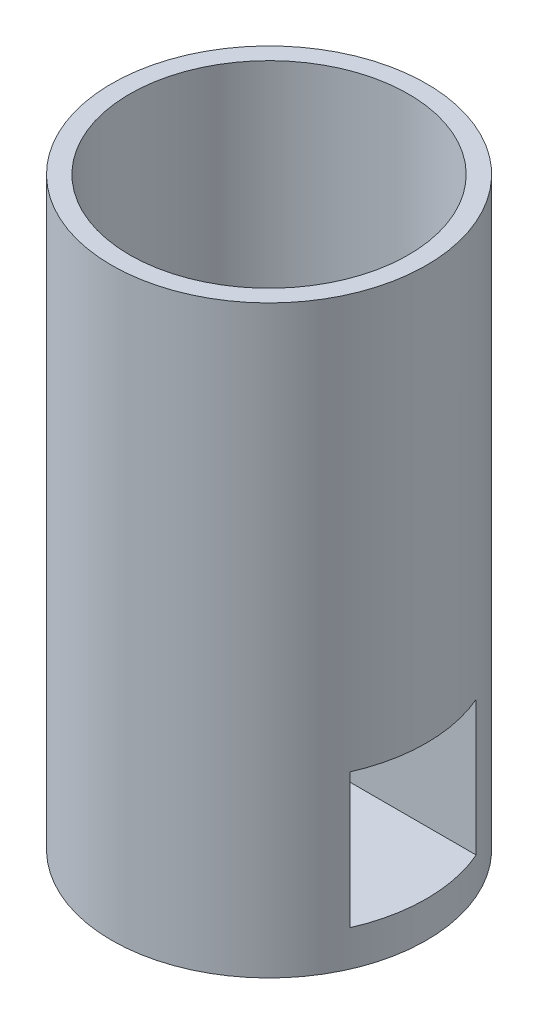
from build123d import *

# Parameters (mm, degrees)
SKETCH1_W               = 25
SKETCH1_H               = 16
BOSS_EXTRUDE1_DEPTH     = 20
SKETCH6_R               = 17.5
BOSS_EXTRUDE4_DEPTH     = 65
CUT_EXTRUDE1_DEPTH      = 65
CUT_EXTRUDE1_DEPTH_BACK = 40
SKETCH2_W               = 14
SKETCH2_H               = 15
SKETCH3_R               = 1
CUT_EXTRUDE2_DEPTH      = 10
SKETCH7_R               = 15.5
CUT_EXTRUDE3_DEPTH      = 30


with BuildPart() as part:
    # Sketch1 → Boss-Extrude1 (new body)
    with BuildSketch(Plane(origin=(0, 0, 0), x_dir=(1, 0, 0), z_dir=(0, 1, 0))):
        with Locations((3.281818182, -1.972727273)):
            Rectangle(SKETCH1_W, SKETCH1_H)
    extrude(amount=BOSS_EXTRUDE1_DEPTH)

    # Sketch6 → Boss-Extrude4 (add)
    with BuildSketch(Plane(origin=(0, 0, 0), x_dir=(1, 0, 0), z_dir=(0, 1, 0))):
        with Locations(Location((3.872523773, -1.953116283, 0), (0, 0, 270))):
            Circle(SKETCH6_R)
    extrude(amount=BOSS_EXTRUDE4_DEPTH)

    # Sketch2 → Cut-Extrude1 (cut, two sides: drawn at the far end of the back side and taken through both)
    with BuildSketch(Plane.ZY.offset(9.218181818).offset(-CUT_EXTRUDE1_DEPTH_BACK)):
        with Locations((1.972727273, 11.5)):
            Rectangle(SKETCH2_W, SKETCH2_H)
    extrude(amount=CUT_EXTRUDE1_DEPTH + CUT_EXTRUDE1_DEPTH_BACK, mode=Mode.SUBTRACT)

    # Sketch3 → Cut-Extrude2 (cut)
    with BuildSketch(Plane(origin=(0, 0, 0), x_dir=(-1, 0, 0), z_dir=(0, -1, 0))):
        with Locations(Location((-9.781818182, -1.972727273, 0), (0, 0, 90))):
            Circle(SKETCH3_R)
        with Locations(Location((0.218181818, -1.972727273, 0), (0, 0, 90))):
            Circle(SKETCH3_R)
    extrude(amount=-CUT_EXTRUDE2_DEPTH, mode=Mode.SUBTRACT)

    # Sketch7 → Cut-Extrude3 (cut)
    with BuildSketch(Plane(origin=(0, 65, 0), x_dir=(1, 0, 0), z_dir=(0, 1, 0))):
        with Locations(Location((3.872523773, -1.953116283, 0), (0, 0, 270))):
            Circle(SKETCH7_R)
    extrude(amount=-CUT_EXTRUDE3_DEPTH, mode=Mode.SUBTRACT)


solid = part.part
